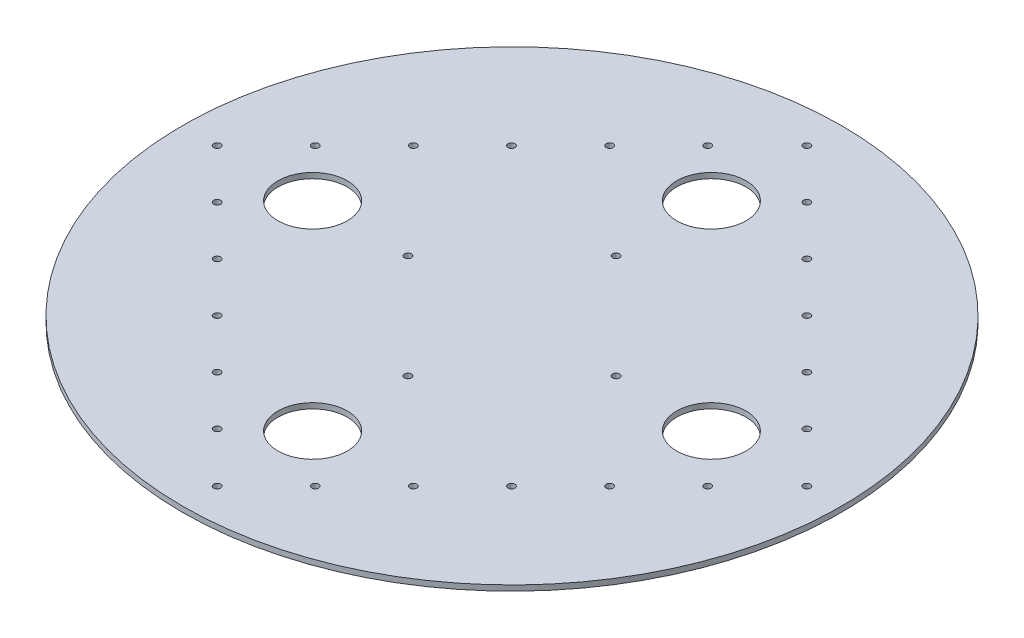
from build123d import *

# Parameters (mm, degrees)
SKETCH1_R           = 190
SKETCH1_R_2         = 2
BOSS_EXTRUDE1_DEPTH = 3.125
SKETCH2_R           = 2
CUT_EXTRUDE2_DEPTH  = 3.125
SKETCH3_R           = 20
CUT_EXTRUDE3_DEPTH  = 3.125


with BuildPart() as part:
    # Sketch1 → Boss-Extrude1 (new body)
    with BuildSketch(Plane(origin=(0, 0, 0), x_dir=(1, 0, 0), z_dir=(0, 1, 0))):
        with Locations(Location((0, 0, 0), (0, 0, 270))):
            Circle(SKETCH1_R)
        with Locations(Location((0, -170, 0), (0, 0, 270))):
            Circle(SKETCH1_R_2, mode=Mode.SUBTRACT)
        with Locations(Location((-170, 0, 0), (0, 0, 270))):
            Circle(SKETCH1_R_2, mode=Mode.SUBTRACT)
        with Locations(Location((0, 170, 0), (0, 0, 270))):
            Circle(SKETCH1_R_2, mode=Mode.SUBTRACT)
        with Locations(Location((170, 0, 0), (0, 0, 270))):
            Circle(SKETCH1_R_2, mode=Mode.SUBTRACT)
        with Locations(Location((-141.715728753, 28.284271247, 0), (0, 0, 270))):
            Circle(SKETCH1_R_2, mode=Mode.SUBTRACT)
        with Locations(Location((-113.431457505, 56.568542495, 0), (0, 0, 270))):
            Circle(SKETCH1_R_2, mode=Mode.SUBTRACT)
        with Locations(Location((-85.147186258, 84.852813742, 0), (0, 0, 270))):
            Circle(SKETCH1_R_2, mode=Mode.SUBTRACT)
        with Locations(Location((-56.86291501, 113.13708499, 0), (0, 0, 270))):
            Circle(SKETCH1_R_2, mode=Mode.SUBTRACT)
        with Locations(Location((-28.578643763, 141.421356237, 0), (0, 0, 270))):
            Circle(SKETCH1_R_2, mode=Mode.SUBTRACT)
        with Locations(Location((-141.715728753, -28.284271247, 0), (0, 0, 270))):
            Circle(SKETCH1_R_2, mode=Mode.SUBTRACT)
        with Locations(Location((28.284271247, 141.715728753, 0), (0, 0, 270))):
            Circle(SKETCH1_R_2, mode=Mode.SUBTRACT)
        with Locations(Location((-113.431457505, -56.568542495, 0), (0, 0, 270))):
            Circle(SKETCH1_R_2, mode=Mode.SUBTRACT)
        with Locations(Location((56.568542495, 113.431457505, 0), (0, 0, 270))):
            Circle(SKETCH1_R_2, mode=Mode.SUBTRACT)
        with Locations(Location((-85.147186258, -84.852813742, 0), (0, 0, 270))):
            Circle(SKETCH1_R_2, mode=Mode.SUBTRACT)
        with Locations(Location((84.852813742, 85.147186258, 0), (0, 0, 270))):
            Circle(SKETCH1_R_2, mode=Mode.SUBTRACT)
        with Locations(Location((-56.86291501, -113.13708499, 0), (0, 0, 270))):
            Circle(SKETCH1_R_2, mode=Mode.SUBTRACT)
        with Locations(Location((113.13708499, 56.86291501, 0), (0, 0, 270))):
            Circle(SKETCH1_R_2, mode=Mode.SUBTRACT)
        with Locations(Location((-28.578643763, -141.421356237, 0), (0, 0, 270))):
            Circle(SKETCH1_R_2, mode=Mode.SUBTRACT)
        with Locations(Location((141.421356237, 28.578643763, 0), (0, 0, 270))):
            Circle(SKETCH1_R_2, mode=Mode.SUBTRACT)
        with Locations(Location((28.284271247, -141.715728753, 0), (0, 0, 270))):
            Circle(SKETCH1_R_2, mode=Mode.SUBTRACT)
        with Locations(Location((56.568542495, -113.431457505, 0), (0, 0, 270))):
            Circle(SKETCH1_R_2, mode=Mode.SUBTRACT)
        with Locations(Location((84.852813742, -85.147186258, 0), (0, 0, 270))):
            Circle(SKETCH1_R_2, mode=Mode.SUBTRACT)
        with Locations(Location((113.13708499, -56.86291501, 0), (0, 0, 270))):
            Circle(SKETCH1_R_2, mode=Mode.SUBTRACT)
        with Locations(Location((141.421356237, -28.578643763, 0), (0, 0, 270))):
            Circle(SKETCH1_R_2, mode=Mode.SUBTRACT)
    extrude(amount=BOSS_EXTRUDE1_DEPTH)

    # Sketch2 → Cut-Extrude2 (cut)
    with BuildSketch(Plane(origin=(0, 3.125, 0), x_dir=(1, 0, 0), z_dir=(0, 1, 0))):
        with Locations(Location((-60, 0, 0), (0, 0, 270))):
            Circle(SKETCH2_R)
        with Locations(Location((0, 60, 0), (0, 0, 270))):
            Circle(SKETCH2_R)
        with Locations(Location((60, 0, 0), (0, 0, 270))):
            Circle(SKETCH2_R)
        with Locations(Location((0, -60, 0), (0, 0, 270))):
            Circle(SKETCH2_R)
    extrude(amount=-CUT_EXTRUDE2_DEPTH, mode=Mode.SUBTRACT)

    # Sketch3 → Cut-Extrude3 (cut)
    with BuildSketch(Plane(origin=(0, 3.125, 0), x_dir=(1, 0, 0), z_dir=(0, 1, 0))):
        with Locations(Location((-114.941299582, 0, 0), (0, 0, 270))):
            Circle(SKETCH3_R)
        with Locations(Location((0, 114.941299582, 0), (0, 0, 270))):
            Circle(SKETCH3_R)
        with Locations(Location((114.941299582, 0, 0), (0, 0, 270))):
            Circle(SKETCH3_R)
        with Locations(Location((0, -114.941299582, 0), (0, 0, 270))):
            Circle(SKETCH3_R)
    extrude(amount=-CUT_EXTRUDE3_DEPTH, mode=Mode.SUBTRACT)


solid = part.part
